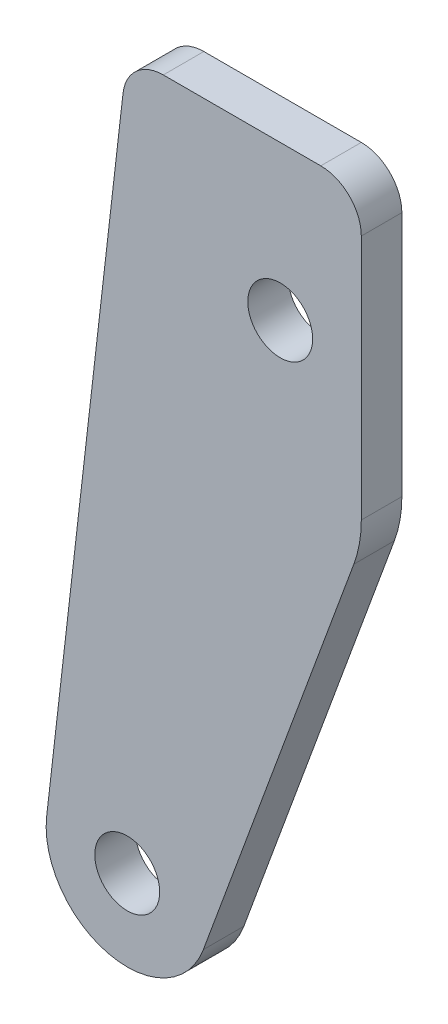
from build123d import *

# Parameters (mm, degrees)
SZKIC1_R                    = 20
SZKIC1_R_2                  = 8
DODANIE_WYCI_GNI_CIE1_DEPTH = 10


with BuildPart() as part:
    # Szkic1 → Dodanie-wyciągnięcie1 (new body)
    # profile 1 of 3: a face of its own
    with BuildSketch(Plane.XY):
        with BuildLine():
            Line((17.736087047, 99), (17.736087047, 175))
            Line((17.736087047, 175), (8.898572724, 175))
            ThreePointArc((8.898572724, 175), (2.243439653, 172.463859847), (-1.036023376, 166.141840763))
            Line((-1.036023376, 166.141840763), (-19.8691922, 2.283681526))
            ThreePointArc((-19.8691922, 2.283681526), (1.143712376, 19.967271271), (20, 0))
            ThreePointArc((20, 0), (19.69005749, -3.507368821), (18.769836395, -6.906029373))
            Line((18.769836395, -6.906029373), (55.890841639, 93.984823763))
            ThreePointArc((55.890841639, 93.984823763), (56.682391116, 96.462784094), (57.25630176, 99))
            Line((57.25630176, 99), (17.736087047, 99))
        make_face()
    # profile 2 of 3: a face of its own
    with BuildSketch(Plane.XY):
        Circle(SZKIC1_R)
        Circle(SZKIC1_R_2, mode=Mode.SUBTRACT)
    # profile 3 of 3: a face of its own
    with BuildSketch(Plane.XY):
        with BuildLine():
            Line((47.736087047, 175), (17.736087047, 175))
            Line((17.736087047, 175), (17.736087047, 99))
            Line((17.736087047, 99), (57.25630176, 99))
            ThreePointArc((57.25630176, 99), (57.615899976, 101.661186457), (57.736087047, 104.343867823))
            Line((57.736087047, 104.343867823), (57.736087047, 165))
            ThreePointArc((57.736087047, 165), (54.807154859, 172.071067812), (47.736087047, 175))
        make_face()
        with Locations((37.736087047, 137)):
            Circle(SZKIC1_R_2, mode=Mode.SUBTRACT)
    extrude(amount=-DODANIE_WYCI_GNI_CIE1_DEPTH)


solid = part.part
